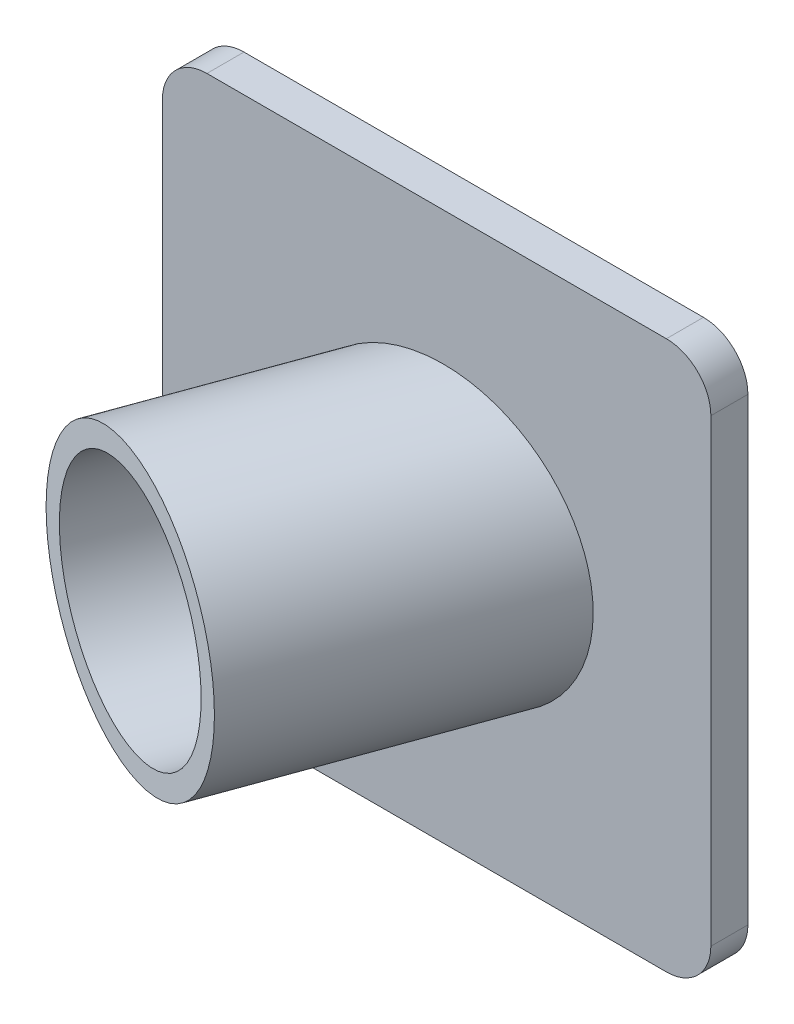
from build123d import *

# Parameters (mm, degrees)
EXTRUDE_1_DEPTH     = 2.5
EXTRUDE_3_REACH     = 31.489
SKETCH_6_R          = 9.5
EXTRUDE_START       = 10
SKETCH_12_R         = 9.5
EXTRUDE_4_DEPTH     = 10
CUT_EXTRUDE_4_REACH = 37.632
SKETCH_13_R         = 8


with BuildPart() as part:
    # 草圖1 → 填料-伸長1 (new body)
    with BuildSketch(Plane.XY):
        with BuildLine():
            Line((-15.5, -18.5), (15.5, -18.5))
            ThreePointArc((15.5, -18.5), (17.621320344, -17.621320344), (18.5, -15.5))
            Line((18.5, -15.5), (18.5, 15.5))
            ThreePointArc((18.5, 15.5), (17.621320344, 17.621320344), (15.5, 18.5))
            Line((15.5, 18.5), (-15.5, 18.5))
            ThreePointArc((-15.5, 18.5), (-17.621320344, 17.621320344), (-18.5, 15.5))
            Line((-18.5, 15.5), (-18.5, -15.5))
            ThreePointArc((-18.5, -15.5), (-17.621320344, -17.621320344), (-15.5, -18.5))
        make_face()
    extrude(amount=EXTRUDE_1_DEPTH)

    # 填料-伸長3: up to this plane
    extrude_3_end = Plane(origin=(-15.5, 15.5, 2.5), z_dir=(0, 0, -1))
    # 草圖6 → 填料-伸長3 (add, up to the surface)
    with BuildSketch(Plane(origin=(-2.967573413, 0, 8.153340943), x_dir=(0, -1, 0), z_dir=(-0.34202014332566943, 0, 0.9396926207859081)), mode=Mode.PRIVATE) as extrude_3_sk1:
        with Locations(Location((0, 1.280349356, 0), (0, 0, 90))):
            Circle(SKETCH_6_R)
    extrude_3_tool1 = split(extrude(extrude_3_sk1.sketch, amount=-EXTRUDE_3_REACH, mode=Mode.PRIVATE), bisect_by=extrude_3_end, keep=Keep.BOTH, mode=Mode.PRIVATE)
    add(extrude_3_tool1.solids().sort_by_distance((-1.764439, 0, 8.591246))[0])

    # 草圖12 → 填料-伸長4 (add)
    with BuildSketch(Plane(origin=(-2.967573413, 0, 8.153340943), x_dir=(0.9396926207859082, 0, 0.3420201433256695), z_dir=(-0.3420201433256695, 0, 0.9396926207859082)).offset(EXTRUDE_START)):
        with Locations((1.280349356, 0)):
            Circle(SKETCH_12_R)
    extrude(amount=-EXTRUDE_4_DEPTH)

    # 除料-伸長4: up to this plane
    cut_extrude_4_end = Plane(origin=(-15.5, 15.5, 2.5), z_dir=(0, 0, -1))
    # 草圖13 → 除料-伸長4 (cut, up to the surface)
    with BuildSketch(Plane(origin=(-6.387774847, 0, 17.550267151), x_dir=(0.9396926207859082, 0, 0.3420201433256695), z_dir=(-0.3420201433256695, 0, 0.9396926207859082)), mode=Mode.PRIVATE) as cut_extrude_4_sk1:
        with Locations((1.280349356, 0)):
            Circle(SKETCH_13_R)
    cut_extrude_4_tool1 = split(extrude(cut_extrude_4_sk1.sketch, amount=-CUT_EXTRUDE_4_REACH, mode=Mode.PRIVATE), bisect_by=cut_extrude_4_end, keep=Keep.BOTH, mode=Mode.PRIVATE)
    add(cut_extrude_4_tool1.solids().sort_by_distance((-5.18464, 0, 17.988172))[0], mode=Mode.SUBTRACT)


solid = part.part
